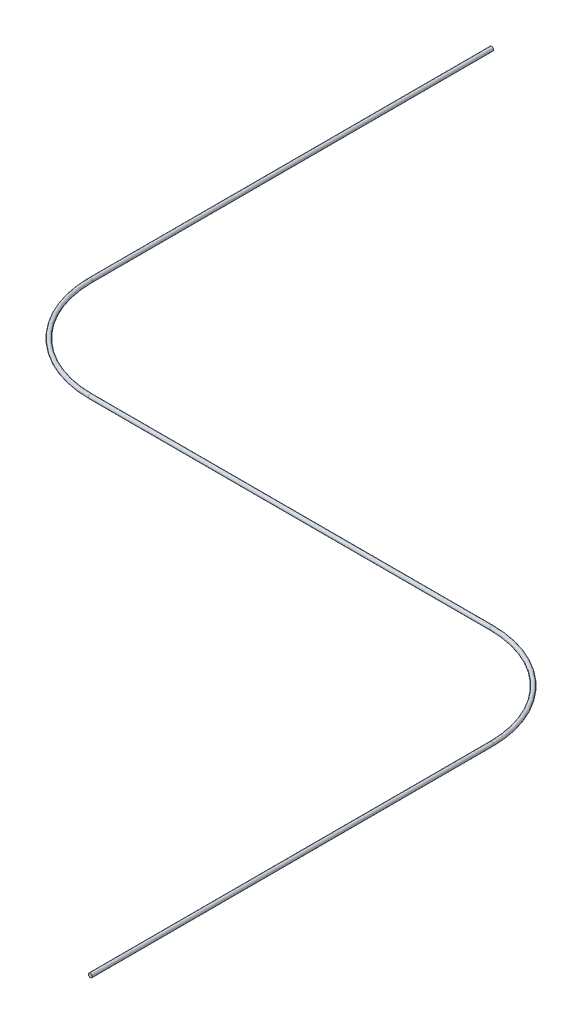
from build123d import *

# Parameters (mm, degrees)
SKETCH2_R = 2


with BuildPart() as part:
    # Sweep1: sweep along a path in Sketch1
    with BuildLine(Plane(origin=(0, 0, 0), x_dir=(1, 0, 0), z_dir=(0, 1, 0))) as sweep1_path:
        Line((0, 0), (0, 400))
        ThreePointArc((0, 400), (-29.289321881, 470.710678119), (-100, 500))
        Line((-100, 500), (-500, 500))
        ThreePointArc((-500, 500), (-570.710678119, 529.289321881), (-600, 600))
        Line((-600, 600), (-600, 1000))
    # Sketch2 → Sweep1 (sweep)
    with BuildSketch(Plane.XY):
        Circle(SKETCH2_R)
    sweep(path=sweep1_path.line)


solid = part.part
